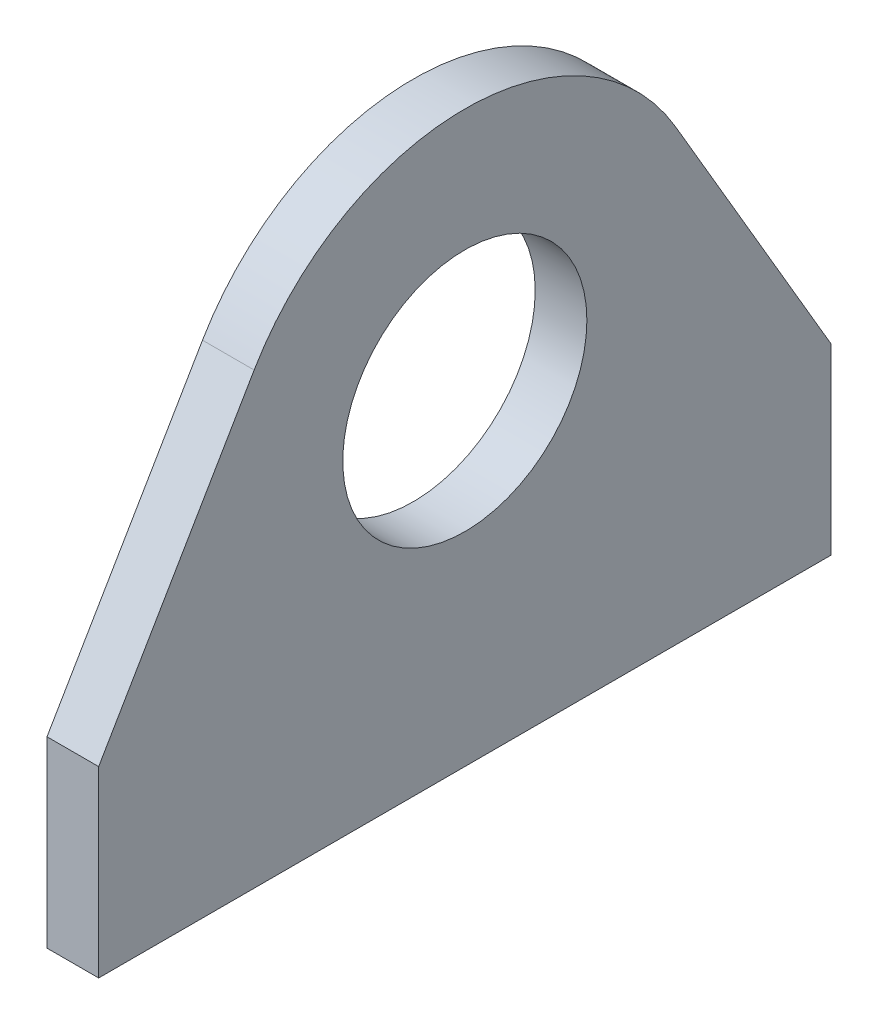
from build123d import *

# Parameters (mm, degrees)
SKETCH1_R           = 30
BOSS_EXTRUDE1_DEPTH = 6.35


with BuildPart() as part:
    # Sketch1 → Boss-Extrude1 (new, symmetric)
    with BuildSketch(Plane(origin=(0, 0, 0), x_dir=(0, 0, -1), z_dir=(1, 0, 0))):
        with BuildLine():
            Line((90, 0), (90, 45))
            Line((90, 45), (51.784861392, 110.303929293))
            ThreePointArc((51.784861392, 110.303929293), (0, 140), (-51.784861392, 110.303929293))
            Line((-51.784861392, 110.303929293), (-90, 45))
            Line((-90, 45), (-90, 0))
            Line((-90, 0), (90, 0))
        make_face()
        with Locations((0, 80)):
            Circle(SKETCH1_R, mode=Mode.SUBTRACT)
    extrude(amount=BOSS_EXTRUDE1_DEPTH, both=True)


solid = part.part
